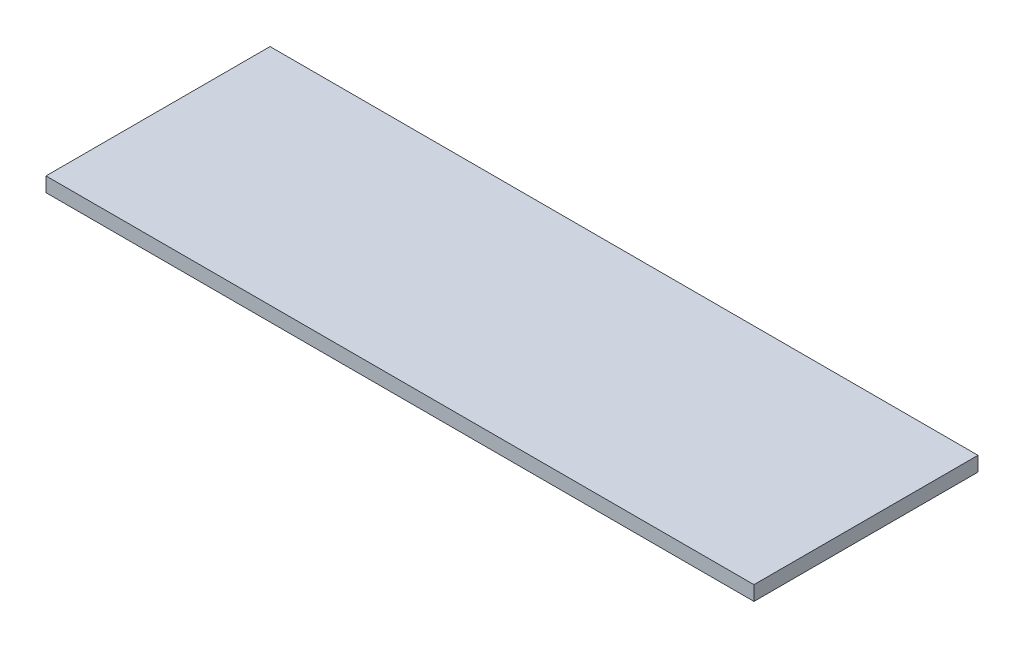
from build123d import *

# Parameters (mm, degrees)
SKETCH1_W           = 316
SKETCH1_H           = 100
BOSS_EXTRUDE1_DEPTH = 6.5


with BuildPart() as part:
    # Sketch1 → Boss-Extrude1 (new body)
    with BuildSketch(Plane(origin=(0, 0, 0), x_dir=(1, 0, 0), z_dir=(0, 1, 0))):
        with Locations((158, 50)):
            Rectangle(SKETCH1_W, SKETCH1_H)
    extrude(amount=BOSS_EXTRUDE1_DEPTH)


solid = part.part
